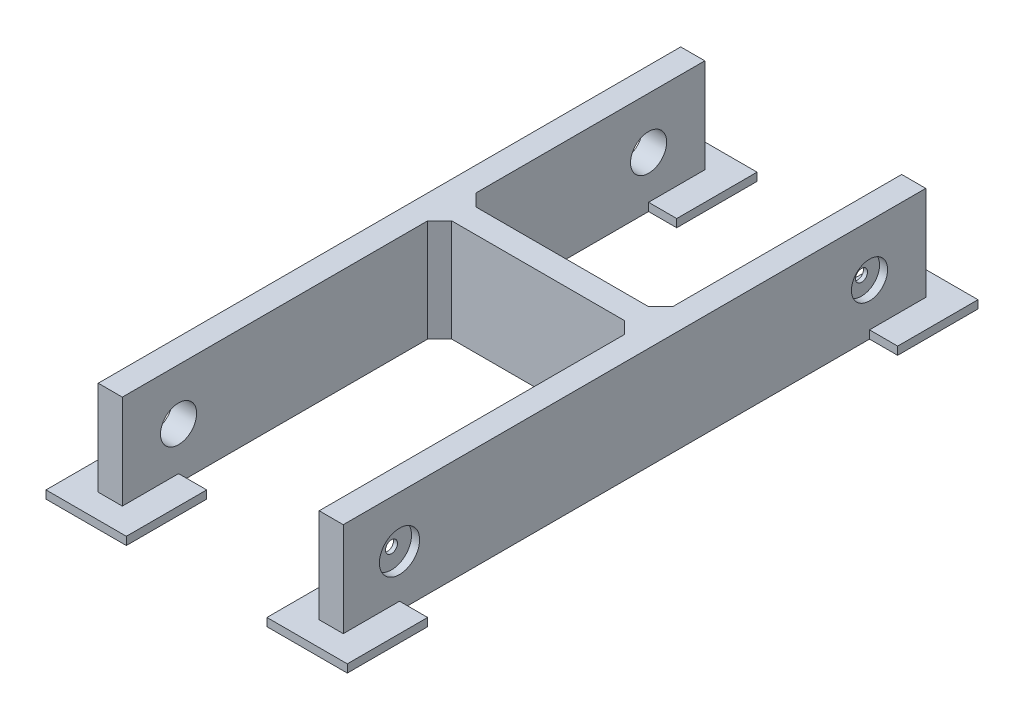
from build123d import *

# Parameters (mm, degrees)
BOSS_EXTRUDE1_DEPTH     = 25.5
SKETCH2_R               = 4.5
CUT_EXTRUDE1_DEPTH      = 25
SKETCH3_R               = 1.5
CUT_EXTRUDE2_DEPTH      = 10
SKETCH4_R               = 5
CUT_EXTRUDE3_DEPTH      = 2
CUT_EXTRUDE4_DEPTH      = 3
CUT_EXTRUDE5_DEPTH      = 3
SKETCH7_R               = 4.5
CUT_EXTRUDE6_DEPTH      = 2
CUT_EXTRUDE7_DEPTH      = 108.685885798
CUT_EXTRUDE7_DEPTH_BACK = 108.685885798
SKETCH8_R               = 1.5
CUT_EXTRUDE8_START      = -10
SKETCH9_R               = 4.5
CUT_EXTRUDE8_DEPTH      = 10
BOSS_EXTRUDE2_DEPTH     = 25.5
SKETCH11_W              = 20
SKETCH11_H              = 20
BOSS_EXTRUDE3_DEPTH     = 2


with BuildPart() as part:
    # Sketch1 → Boss-Extrude1 (new body)
    with BuildSketch(Plane(origin=(0, 0, 0), x_dir=(1, 0, 0), z_dir=(0, 1, 0))):
        Polygon((6, -6), (55, -6), (55, -85), (61, -85), (61, 60), (55, 60), (55, 0), (6, 0), (6, 60), (0, 60), (0, -85), (6, -85), align=None)
    extrude(amount=BOSS_EXTRUDE1_DEPTH)

    # Sketch2 → Cut-Extrude1 (cut)
    with BuildSketch(Plane(origin=(6, 0, 0), x_dir=(0, 0, -1), z_dir=(1, 0, 0))):
        with Locations((-71, 12.75)):
            Circle(SKETCH2_R)
    extrude(amount=-CUT_EXTRUDE1_DEPTH, mode=Mode.SUBTRACT)

    # Sketch3 → Cut-Extrude2 (cut)
    with BuildSketch(Plane.ZY.offset(-55)):
        with Locations((71, 12.75)):
            Circle(SKETCH3_R)
    extrude(amount=-CUT_EXTRUDE2_DEPTH, mode=Mode.SUBTRACT)

    # Sketch4 → Cut-Extrude3 (cut)
    with BuildSketch(Plane(origin=(61, 0, 0), x_dir=(0, 0, -1), z_dir=(1, 0, 0))):
        with Locations((-71, 12.75)):
            Circle(SKETCH4_R)
    extrude(amount=-CUT_EXTRUDE3_DEPTH, mode=Mode.SUBTRACT)

    # Sketch5 → Cut-Extrude4 (cut)
    with BuildSketch(Plane.ZY.offset(-55)):
        with BuildLine():
            Line((71, 19.25), (54, 15.75))
            ThreePointArc((54, 15.75), (51, 12.75), (54, 9.75))
            Line((54, 9.75), (71, 6.25))
            ThreePointArc((71, 6.25), (77.5, 12.75), (71, 19.25))
        make_face()
    extrude(amount=-CUT_EXTRUDE4_DEPTH, mode=Mode.SUBTRACT)

    # Sketch6 → Cut-Extrude5 (cut)
    with BuildSketch(Plane.ZY.offset(-55)):
        with BuildLine():
            Line((-29, 9.75), (-46, 6.25))
            ThreePointArc((-46, 6.25), (-52.5, 12.75), (-46, 19.25))
            Line((-46, 19.25), (-29, 15.75))
            ThreePointArc((-29, 15.75), (-26, 12.75), (-29, 9.75))
        make_face()
    extrude(amount=-CUT_EXTRUDE5_DEPTH, mode=Mode.SUBTRACT)

    # Sketch7 → Cut-Extrude6 (cut)
    with BuildSketch(Plane(origin=(61, 0, 0), x_dir=(0, 0, -1), z_dir=(1, 0, 0))):
        with Locations((46, 12.75)):
            Circle(SKETCH7_R)
    extrude(amount=-CUT_EXTRUDE6_DEPTH, mode=Mode.SUBTRACT)

    # Sketch8 → Cut-Extrude7 (cut, two sides: drawn at the far end of the back side and taken through both)
    with BuildSketch(Plane(origin=(61, 0, 0), x_dir=(0, 0, -1), z_dir=(1, 0, 0)).offset(-CUT_EXTRUDE7_DEPTH_BACK)):
        with Locations((46, 12.75)):
            Circle(SKETCH8_R)
    extrude(amount=CUT_EXTRUDE7_DEPTH + CUT_EXTRUDE7_DEPTH_BACK, mode=Mode.SUBTRACT)

    # Sketch9 → Cut-Extrude8 (cut)
    with BuildSketch(Plane.ZY.offset(CUT_EXTRUDE8_START)):
        with Locations(Location((-46, 12.75, 0), (0, 0, 180))):
            Circle(SKETCH9_R)
    extrude(amount=CUT_EXTRUDE8_DEPTH, mode=Mode.SUBTRACT)

    # Sketch10 → Boss-Extrude2 (add)
    with BuildSketch(Plane(origin=(0, 25.5, 0), x_dir=(1, 0, 0), z_dir=(0, 1, 0))):
        Polygon((9, -6), (6, -6), (6, -9), align=None)
        Polygon((6, 0), (6, 3), (9, 0), align=None)
        Polygon((52, 0), (55, 0), (55, 3), align=None)
        Polygon((55, -6), (55, -9), (52, -6), align=None)
    extrude(amount=-BOSS_EXTRUDE2_DEPTH)

    # Sketch11 → Boss-Extrude3 (add)
    with BuildSketch(Plane.XZ):
        with Locations((3, -56)):
            Rectangle(SKETCH11_W, SKETCH11_H)
        with Locations((3, 81)):
            Rectangle(SKETCH11_W, SKETCH11_H)
        with Locations((58, 81)):
            Rectangle(SKETCH11_W, SKETCH11_H)
        with Locations((58, -56)):
            Rectangle(SKETCH11_W, SKETCH11_H)
    extrude(amount=-BOSS_EXTRUDE3_DEPTH)


solid = part.part
